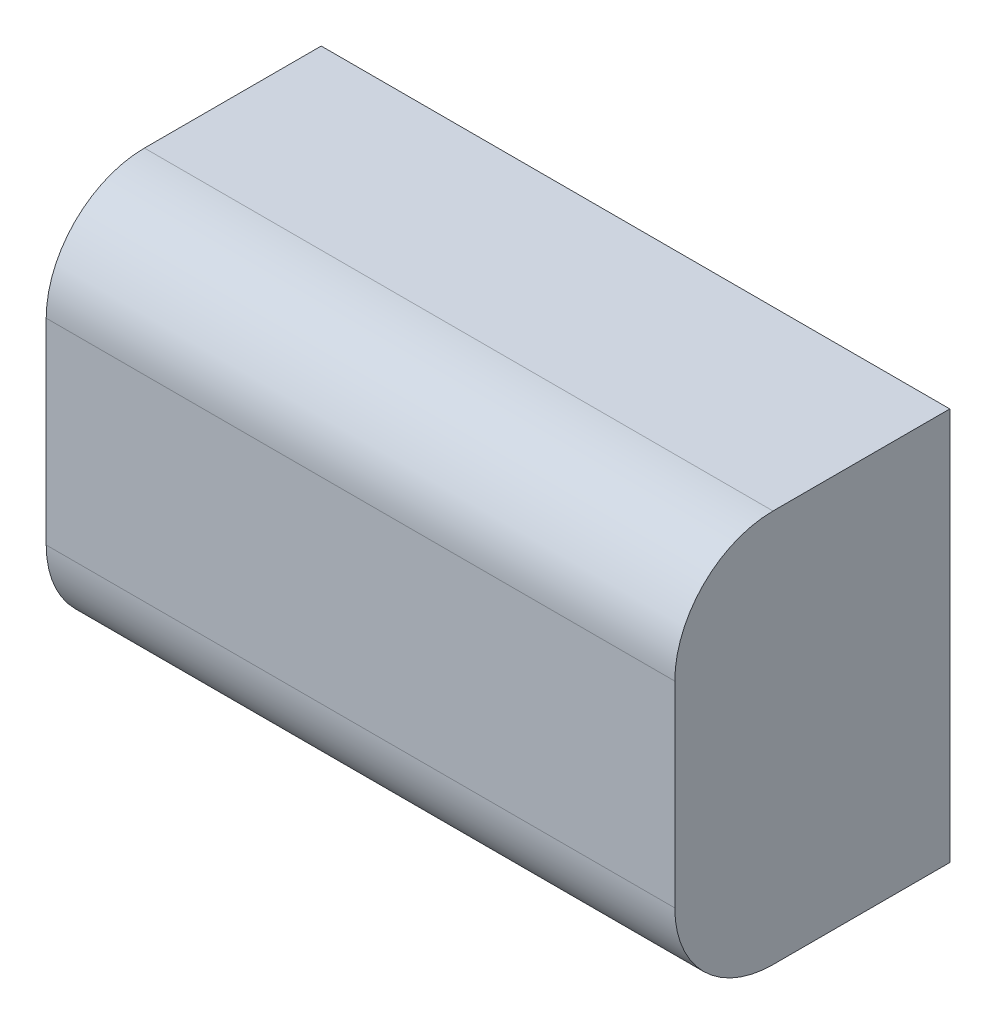
from build123d import *

# Parameters (mm, degrees)
SKETCH1_W           = 203.2
SKETCH1_H           = 127
BOSS_EXTRUDE1_DEPTH = 44.45
FILLET1_R           = 31.75
SKETCH3_R           = 4.7625
CUT_EXTRUDE1_DEPTH  = 25.4


with BuildPart() as part:
    # Sketch1 → Boss-Extrude1 (new, symmetric)
    with BuildSketch(Plane.XY):
        Rectangle(SKETCH1_W, SKETCH1_H)
    extrude(amount=BOSS_EXTRUDE1_DEPTH, both=True)

    # Fillet1
    fillet1_edges = [part.edges().sort_by_distance(p)[0] for p in [
        (0, -63.5, 44.45),
        (0, 63.5, 44.45),
    ]]
    fillet(fillet1_edges, radius=FILLET1_R)

    # Sketch3 → Cut-Extrude1 (cut)
    with BuildSketch(Plane(origin=(0, 0, -44.45), x_dir=(-1, 0, 0), z_dir=(0, 0, -1))):
        with Locations((-12.7, 0)):
            Circle(SKETCH3_R)
        with Locations((12.7, 0)):
            Circle(SKETCH3_R)
    extrude(amount=-CUT_EXTRUDE1_DEPTH, mode=Mode.SUBTRACT)


solid = part.part
